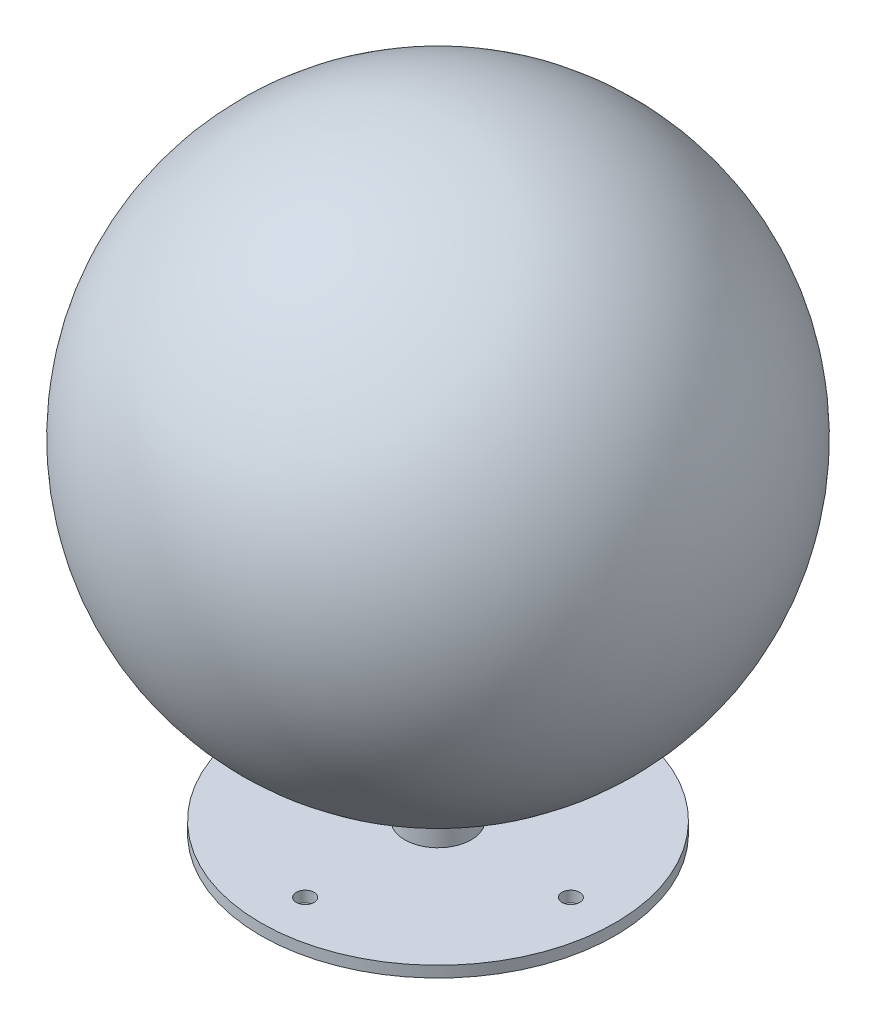
from build123d import *

# Parameters (mm, degrees)
SKETCH_1_R      = 80
EXTRUDE_1_DEPTH = 5
MM_1_D          = 8
MM_1_DEPTH      = 20
MM_1_TIP        = 2.403442476
SKETCH_4_W      = 15
SKETCH_4_H      = 30


with BuildPart() as part:
    # 草图1 → 凸台-拉伸1 (new body)
    with BuildSketch(Plane(origin=(0, 0, 0), x_dir=(1, 0, 0), z_dir=(0, 1, 0))):
        with Locations(Location((0, 0, 0), (0, 0, 270))):
            Circle(SKETCH_1_R)
    extrude(amount=EXTRUDE_1_DEPTH)

    # 大小mm 暗销孔1
    with Locations(Plane(origin=(0, 5, -60), x_dir=(0, 0, 1), z_dir=(0, 1, 0))):
        with Locations((0, 0), (60, -60), (60, 60), (120, 0)):
            Hole(MM_1_D / 2, depth=MM_1_DEPTH)
            with Locations((0, 0, -(MM_1_DEPTH + MM_1_TIP / 2))):  # 118° drill point
                Cone(0, MM_1_D / 2, MM_1_TIP, mode=Mode.SUBTRACT)

    # 草图4 → 旋转1 (revolve)
    with BuildSketch(Plane.XY, mode=Mode.PRIVATE) as revolve_1_sk:
        with Locations((7.5, 20)):
            Rectangle(SKETCH_4_W, SKETCH_4_H)
    revolve(revolve_1_sk.sketch.rotate(Axis((0, 5, 0), (0, 1, 0)), 90), axis=Axis((0, 5, 0), (0, 1, 0)))

    # 草图5 → 旋转2 (revolve)
    with BuildSketch(Plane.XY):
        with BuildLine():
            Line((0, 35), (0, 30))
            ThreePointArc((0, 30), (-125, 155), (0, 280))
            Line((0, 280), (0, 35))
        make_face()
    revolve(axis=Axis((0, 35, 0), (0, 1, 0)))


solid = part.part
